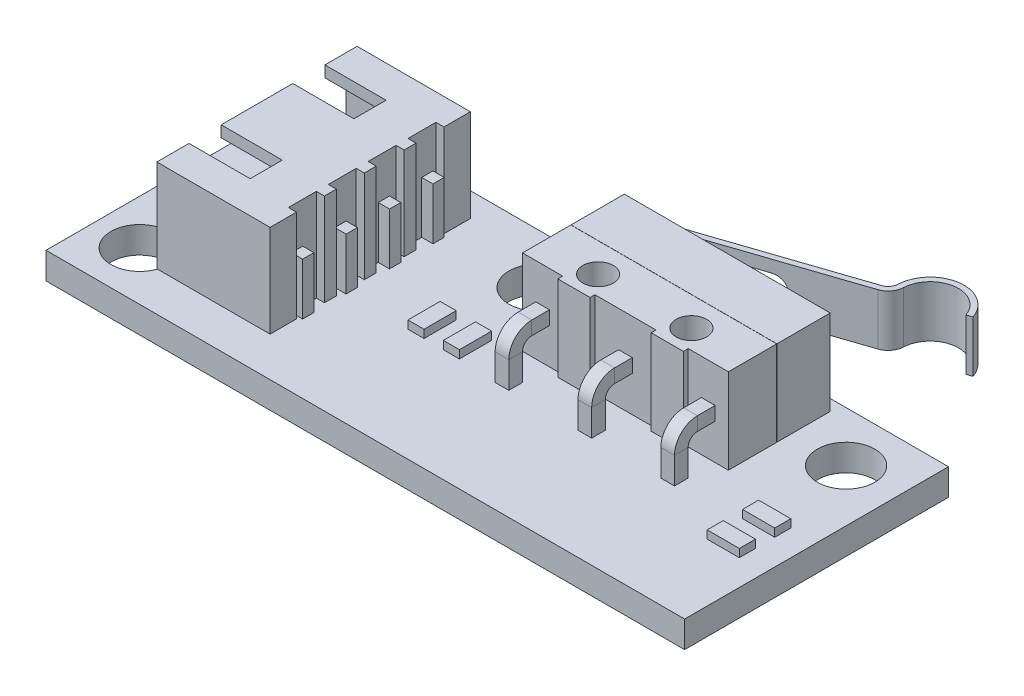
from build123d import *

# Parameters (mm, degrees)
SKETCH1_W           = 39.7
SKETCH1_H           = 16.4
BOSS_EXTRUDE1_DEPTH = 1.65
SKETCH2_W           = 12.8
SKETCH2_H           = 6.63
BOSS_EXTRUDE2_DEPTH = 5.3
SKETCH3_W           = 2.5
SKETCH3_H           = 0.3
SKETCH3_W_2         = 3.8
SKETCH3_W_3         = 12.8
SKETCH3_H_2         = 0.01
CUT_EXTRUDE1_DEPTH  = 5.3
SKETCH4_R           = 0.95
CUT_EXTRUDE2_DEPTH  = 5.3
BOSS_EXTRUDE3_START = -1.1
BOSS_EXTRUDE3_DEPTH = 3
EXTRUDE_THIN1_START = -1
EXTRUDE_THIN1_DEPTH = 3.2
SKETCH7_W           = 7.04
SKETCH7_H           = 12.45
BOSS_EXTRUDE4_DEPTH = 5.75
SKETCH8_R           = 1.7875
CUT_EXTRUDE3_DEPTH  = 1.65
SKETCH10_W          = 11.05
SKETCH10_H          = 4.35
CUT_EXTRUDE4_DEPTH  = 6.04
SKETCH11_W          = 3.8
SKETCH11_H          = 2
CUT_EXTRUDE5_DEPTH  = 0.7
SKETCH12_W          = 0.7
SKETCH12_H          = 0.7
BOSS_EXTRUDE5_DEPTH = 4
CHAMFER1_SIZE       = 0.2
SKETCH14_W          = 0.5
SKETCH14_H          = 1.7375
CUT_EXTRUDE6_DEPTH  = 5.75
SKETCH16_W          = 0.85
SKETCH16_H          = 0.85
CUT_EXTRUDE7_DEPTH  = 0.35
SKETCH19_W          = 0.7
SKETCH19_H          = 6.875
BOSS_EXTRUDE6_DEPTH = 0.7
SKETCH20_W          = 0.85
SKETCH20_H          = 0.85
BOSS_EXTRUDE7_DEPTH = 1.6
CHAMFER2_SIZE       = 0.2
SKETCH21_W          = 2
SKETCH21_H          = 1
SKETCH21_W_2        = 1
SKETCH21_H_2        = 2
BOSS_EXTRUDE8_DEPTH = 0.5


with BuildPart() as part:
    # Sketch1 → Boss-Extrude1 (new body)
    with BuildSketch(Plane(origin=(0, 0, 0), x_dir=(1, 0, 0), z_dir=(0, 1, 0))):
        Rectangle(SKETCH1_W, SKETCH1_H)
    extrude(amount=BOSS_EXTRUDE1_DEPTH)

    # Sketch2 → Boss-Extrude2 (add)
    with BuildSketch(Plane(origin=(0, 1.65, 0), x_dir=(1, 0, 0), z_dir=(0, 1, 0))):
        with Locations((6.8, 4.185)):
            Rectangle(SKETCH2_W, SKETCH2_H)
    extrude(amount=BOSS_EXTRUDE2_DEPTH)

    # Sketch3 → Cut-Extrude1 (cut)
    with BuildSketch(Plane(origin=(0, 6.95, 0), x_dir=(1, 0, 0), z_dir=(0, 1, 0))):
        with Locations((1.65, 1.02)):
            Rectangle(SKETCH3_W, SKETCH3_H)
        with Locations((6.8, 1.02)):
            Rectangle(SKETCH3_W_2, SKETCH3_H)
        with Locations((11.95, 1.02)):
            Rectangle(SKETCH3_W, SKETCH3_H)
        with Locations((6.8, 4.18)):
            Rectangle(SKETCH3_W_3, SKETCH3_H_2)
    extrude(amount=-CUT_EXTRUDE1_DEPTH, mode=Mode.SUBTRACT)

    # Sketch4 → Cut-Extrude2 (cut)
    with BuildSketch(Plane(origin=(0, 6.95, 0), x_dir=(1, 0, 0), z_dir=(0, 1, 0))):
        with Locations(Location((3.9, 2.37, 0), (0, 0, 270))):
            Circle(SKETCH4_R)
        with Locations(Location((9.7, 2.37, 0), (0, 0, 270))):
            Circle(SKETCH4_R)
    extrude(amount=-CUT_EXTRUDE2_DEPTH, mode=Mode.SUBTRACT)

    # Sketch5 → Boss-Extrude3 (add)
    with BuildSketch(Plane(origin=(0, 6.95, 0), x_dir=(1, 0, 0), z_dir=(0, 1, 0)).offset(BOSS_EXTRUDE3_START)):
        with BuildLine():
            Line((3.65, 7.5), (3.65, 7.75))
            ThreePointArc((3.65, 7.75), (4.4, 8.5), (5.15, 7.75))
            Line((5.15, 7.75), (5.15, 7.5))
            ThreePointArc((5.15, 7.5), (4.4, 6.75), (3.65, 7.5))
        make_face()
    extrude(amount=-BOSS_EXTRUDE3_DEPTH)

    # Sketch7 → Boss-Extrude4 (add)
    with BuildSketch(Plane(origin=(0, 1.65, 0), x_dir=(1, 0, 0), z_dir=(0, 1, 0))):
        with Locations((-11.89, 0.475)):
            Rectangle(SKETCH7_W, SKETCH7_H)
    extrude(amount=BOSS_EXTRUDE4_DEPTH)

    # Sketch8 → Cut-Extrude3 (cut)
    with BuildSketch(Plane.XZ):
        with Locations(Location((16.6125, -5.0725, 0), (0, 0, 270))):
            Circle(SKETCH8_R)
        with Locations(Location((-2.5625, -5.0725, 0), (0, 0, 270))):
            Circle(SKETCH8_R)
        with Locations(Location((-17.0625, -5.6125, 0), (0, 0, 270))):
            Circle(SKETCH8_R)
        with Locations(Location((-17.0625, 5.1625, 0), (0, 0, 270))):
            Circle(SKETCH8_R)
    extrude(amount=-CUT_EXTRUDE3_DEPTH, mode=Mode.SUBTRACT)

    # Sketch10 → Cut-Extrude4 (cut)
    with BuildSketch(Plane.ZY.offset(15.41)):
        with Locations((-0.475, 4.525)):
            Rectangle(SKETCH10_W, SKETCH10_H)
    extrude(amount=-CUT_EXTRUDE4_DEPTH, mode=Mode.SUBTRACT)

    # Sketch11 → Cut-Extrude5 (cut)
    with BuildSketch(Plane(origin=(0, 7.4, 0), x_dir=(1, 0, 0), z_dir=(0, 1, 0))):
        with Locations((-13.51, 3.7)):
            Rectangle(SKETCH11_W, SKETCH11_H)
        with Locations((-13.51, -2.75)):
            Rectangle(SKETCH11_W, SKETCH11_H)
    extrude(amount=-CUT_EXTRUDE5_DEPTH, mode=Mode.SUBTRACT)

    # Sketch12 → Boss-Extrude5 (add)
    with BuildSketch(Plane.ZY.offset(9.37)):
        with Locations((-4.525, 4.525)):
            Rectangle(SKETCH12_W, SKETCH12_H)
        with Locations((-1.825, 4.525)):
            Rectangle(SKETCH12_W, SKETCH12_H)
        with Locations((0.875, 4.525)):
            Rectangle(SKETCH12_W, SKETCH12_H)
        with Locations((3.575, 4.525)):
            Rectangle(SKETCH12_W, SKETCH12_H)
    extrude(amount=BOSS_EXTRUDE5_DEPTH)

    # Chamfer1
    chamfer1_edges = [part.edges().sort_by_distance(p)[0] for p in [
        (-13.37, 4.525, -4.875),
        (-13.37, 4.175, -4.525),
        (-13.37, 4.525, -4.175),
        (-13.37, 4.875, -4.525),
        (-13.37, 4.525, -2.175),
        (-13.37, 4.175, -1.825),
        (-13.37, 4.525, -1.475),
        (-13.37, 4.875, -1.825),
        (-13.37, 4.525, 0.525),
        (-13.37, 4.175, 0.875),
        (-13.37, 4.525, 1.225),
        (-13.37, 4.875, 0.875),
        (-13.37, 4.525, 3.225),
        (-13.37, 4.175, 3.575),
        (-13.37, 4.525, 3.925),
        (-13.37, 4.875, 3.575),
    ]]
    chamfer(chamfer1_edges, length=CHAMFER1_SIZE)

    # Sketch14 → Cut-Extrude6 (cut)
    with BuildSketch(Plane(origin=(0, 7.4, 0), x_dir=(1, 0, 0), z_dir=(0, 1, 0))):
        with Locations((-8.62, 4.19125)):
            Rectangle(SKETCH14_W, SKETCH14_H)
        with Locations((-8.62, 1.71375)):
            Rectangle(SKETCH14_W, SKETCH14_H)
        with Locations((-8.62, -0.76375)):
            Rectangle(SKETCH14_W, SKETCH14_H)
        with Locations((-8.62, -3.24125)):
            Rectangle(SKETCH14_W, SKETCH14_H)
    extrude(amount=-CUT_EXTRUDE6_DEPTH, mode=Mode.SUBTRACT)

    # Sweep1: sweep along a path in Sketch17
    with BuildLine(Plane.ZY.offset(-2.9)) as sweep1_path:
        Line((-1.17, 4.3), (-0.07, 4.3))
        ThreePointArc((-0.07, 4.3), (0.637106781, 4.007106781), (0.93, 3.3))
        Line((0.93, 3.3), (0.93, 1.65))
    # Sketch16 → Sweep1 (sweep)
    with BuildSketch(Plane.XY.offset(-1.17)):
        with Locations((1.65, 4.3)):
            Rectangle(SKETCH16_W, SKETCH16_H)
        with Locations((6.8, 4.3)):
            Rectangle(SKETCH16_W, SKETCH16_H)
        with Locations((11.95, 4.3)):
            Rectangle(SKETCH16_W, SKETCH16_H)
    sweep(path=sweep1_path.line)


with BuildPart() as body_2:
    # Sketch6 → Extrude-Thin1 (new body)
    with BuildSketch(Plane(origin=(0, 6.95, 0), x_dir=(1, 0, 0), z_dir=(0, 1, 0)).offset(EXTRUDE_THIN1_START)):
        with BuildLine():
            Line((0.829126789, 7.340655037), (1.303056302, 7.5))
            Line((1.303056302, 7.5), (12.430587103, 11.241307376))
            ThreePointArc((12.430587103, 11.241307376), (12.909711321, 11.586262932), (13.110753947, 12.141363117))
            ThreePointArc((13.110753947, 12.141363117), (14.617563639, 13.791006983), (16.517506588, 12.615414739))
            Line((16.517506588, 12.615414739), (16.849257247, 12.726956213))
            ThreePointArc((16.849257247, 12.726956213), (14.569325708, 14.137666906), (12.761154078, 12.158094266))
            ThreePointArc((12.761154078, 12.158094266), (12.630476371, 11.797279146), (12.319045629, 11.573058034))
            Line((12.319045629, 11.573058034), (1.191514828, 7.831750659))
            Line((1.191514828, 7.831750659), (0.717585316, 7.672405696))
            Line((0.717585316, 7.672405696), (0.829126789, 7.340655037))
        make_face()
    extrude(amount=-EXTRUDE_THIN1_DEPTH)


with BuildPart() as cut_extrude7_tool:
    # Sketch18 → Cut-Extrude7 (new body)
    with BuildSketch(Plane(origin=(-2.244747232, 0, -6.676407859), x_dir=(-0.9478590250728701, 0, 0.31868992545718844), z_dir=(-0.3186899254571884, 0, -0.94785902507287))):
        with BuildLine():
            Line((-3.125288117, 3.5), (-10.125288117, 3.5))
            ThreePointArc((-10.125288117, 3.5), (-10.975288117, 4.35), (-10.125288117, 5.2))
            Line((-10.125288117, 5.2), (-3.125288117, 5.2))
            Line((-3.125288117, 5.2), (-3.125288117, 3.5))
        make_face()
    extrude(amount=-CUT_EXTRUDE7_DEPTH)


with BuildPart() as part_1:
    add(part.part)

    # Cut-Extrude7: cut by cut_extrude7_tool
    add(cut_extrude7_tool.part, mode=Mode.SUBTRACT)

    # Sketch19 → Boss-Extrude6 (add)
    with BuildSketch(Plane(origin=(-8.87, 0, 0), x_dir=(0, 0, -1), z_dir=(1, 0, 0))):
        with Locations((-3.575, 1.4375)):
            Rectangle(SKETCH19_W, SKETCH19_H)
        with Locations((-0.875, 1.4375)):
            Rectangle(SKETCH19_W, SKETCH19_H)
        with Locations((1.825, 1.4375)):
            Rectangle(SKETCH19_W, SKETCH19_H)
        with Locations((4.525, 1.4375)):
            Rectangle(SKETCH19_W, SKETCH19_H)
    extrude(amount=BOSS_EXTRUDE6_DEPTH)

    # Sketch20 → Boss-Extrude7 (add)
    with BuildSketch(Plane.XZ):
        with Locations((1.65, 0.93)):
            Rectangle(SKETCH20_W, SKETCH20_H)
        with Locations((6.8, 0.93)):
            Rectangle(SKETCH20_W, SKETCH20_H)
        with Locations((11.95, 0.93)):
            Rectangle(SKETCH20_W, SKETCH20_H)
    extrude(amount=BOSS_EXTRUDE7_DEPTH)

    # Chamfer2
    chamfer2_edges = [part_1.edges().sort_by_distance(p)[0] for p in [
        (-8.87, -2, 3.575),
        (-8.52, -2, 3.925),
        (-8.52, -2, 3.225),
        (-8.17, -2, 3.575),
        (-8.87, -2, 0.875),
        (-8.52, -2, 1.225),
        (-8.52, -2, 0.525),
        (-8.17, -2, 0.875),
        (-8.87, -2, -1.825),
        (-8.52, -2, -1.475),
        (-8.52, -2, -2.175),
        (-8.17, -2, -1.825),
        (-8.87, -2, -4.525),
        (-8.52, -2, -4.175),
        (-8.52, -2, -4.875),
        (-8.17, -2, -4.525),
        (1.225, -1.6, 0.93),
        (1.65, -1.6, 0.505),
        (2.075, -1.6, 0.93),
        (1.65, -1.6, 1.355),
        (6.375, -1.6, 0.93),
        (6.8, -1.6, 0.505),
        (7.225, -1.6, 0.93),
        (6.8, -1.6, 1.355),
        (11.525, -1.6, 0.93),
        (11.95, -1.6, 0.505),
        (12.375, -1.6, 0.93),
        (11.95, -1.6, 1.355),
    ]]
    chamfer(chamfer2_edges, length=CHAMFER2_SIZE)

    # Sketch21 → Boss-Extrude8 (add)
    with BuildSketch(Plane(origin=(0, 1.65, 0), x_dir=(1, 0, 0), z_dir=(0, 1, 0))):
        with Locations((17.25, -0.5)):
            Rectangle(SKETCH21_W, SKETCH21_H)
        with Locations((17.25, -2.7)):
            Rectangle(SKETCH21_W, SKETCH21_H)
        with Locations((-3.85, -0.2)):
            Rectangle(SKETCH21_W_2, SKETCH21_H_2)
        with Locations((-1.65, -0.2)):
            Rectangle(SKETCH21_W_2, SKETCH21_H_2)
    extrude(amount=BOSS_EXTRUDE8_DEPTH)


with BuildPart() as body_2_1:
    add(body_2.part)

    # Cut-Extrude7: cut by cut_extrude7_tool
    add(cut_extrude7_tool.part, mode=Mode.SUBTRACT)


solid = Compound([part_1.part, body_2_1.part])
